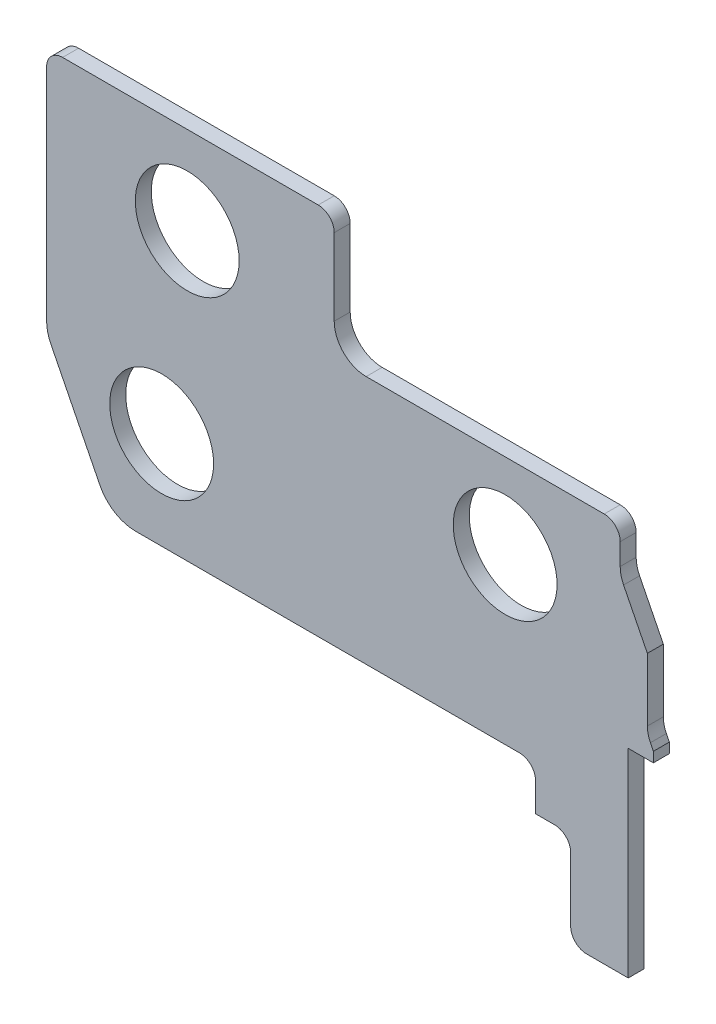
from build123d import *

# Parameters (mm, degrees)
SKETCH1_R           = 3.25
BOSS_EXTRUDE1_DEPTH = 1


with BuildPart() as part:
    # Sketch1 → Boss-Extrude1 (new body)
    with BuildSketch(Plane.XY):
        with BuildLine():
            Line((-77.503167437, 240.042852563), (-77.503167437, 243.984122493))
            Line((-77.503167437, 243.984122493), (-78.99040148, 246.945192005))
            ThreePointArc((-78.99040148, 246.945192005), (-79.149249152, 247.381586959), (-79.203167437, 247.842852563))
            Line((-79.203167437, 247.842852563), (-79.203167437, 249.187318466))
            ThreePointArc((-79.203167437, 249.187318466), (-79.496060656, 249.894425247), (-80.203167437, 250.187318466))
            Line((-80.203167437, 250.187318466), (-95.103167437, 250.187318466))
            ThreePointArc((-95.103167437, 250.187318466), (-96.517380999, 250.773104903), (-97.103167437, 252.187318466))
            Line((-97.103167437, 252.187318466), (-97.103167437, 256.987318466))
            ThreePointArc((-97.103167437, 256.987318466), (-97.396060656, 257.694425247), (-98.103167437, 257.987318466))
            Line((-98.103167437, 257.987318466), (-114.103167437, 257.987318466))
            ThreePointArc((-114.103167437, 257.987318466), (-114.810274218, 257.694425247), (-115.103167437, 256.987318466))
            Line((-115.103167437, 256.987318466), (-115.103167437, 243.19838666))
            ThreePointArc((-115.103167437, 243.19838666), (-115.035769581, 242.621804655), (-114.83720999, 242.076310963))
            Line((-114.83720999, 242.076310963), (-111.767849876, 235.965242768))
            ThreePointArc((-111.767849876, 235.965242768), (-110.846211749, 234.959503948), (-109.533807323, 234.587318466))
            Line((-109.533807323, 234.587318466), (-85.503167437, 234.587318466))
            ThreePointArc((-85.503167437, 234.587318466), (-84.796060656, 234.294425247), (-84.503167437, 233.587318466))
            Line((-84.503167437, 233.587318466), (-84.503167437, 231.787318466))
            Line((-84.503167437, 231.787318466), (-83.303167437, 231.787318466))
            ThreePointArc((-83.303167437, 231.787318466), (-82.596060656, 231.494425247), (-82.303167437, 230.787318466))
            Line((-82.303167437, 230.787318466), (-82.303167437, 226.787318466))
            ThreePointArc((-82.303167437, 226.787318466), (-82.010274218, 226.080211684), (-81.303167437, 225.787318466))
            Line((-81.303167437, 225.787318466), (-78.7, 225.787318466))
            Line((-78.7, 225.787318466), (-78.7, 238.236297682))
            Line((-78.7, 238.236297682), (-77.125227291, 238.236297682))
            Line((-77.125227291, 238.236297682), (-77.125227291, 238.863736239))
            Line((-77.125227291, 238.863736239), (-77.311678075, 239.234958061))
            ThreePointArc((-77.311678075, 239.234958061), (-77.454640981, 239.627713519), (-77.503167437, 240.042852563))
        make_face()
        with Locations((-107.903167437, 240.687318466)):
            Circle(SKETCH1_R, mode=Mode.SUBTRACT)
        with Locations((-86.403167437, 244.887318466)):
            Circle(SKETCH1_R, mode=Mode.SUBTRACT)
        with Locations((-106.303167437, 252.487318466)):
            Circle(SKETCH1_R, mode=Mode.SUBTRACT)
    extrude(amount=BOSS_EXTRUDE1_DEPTH)


solid = part.part
